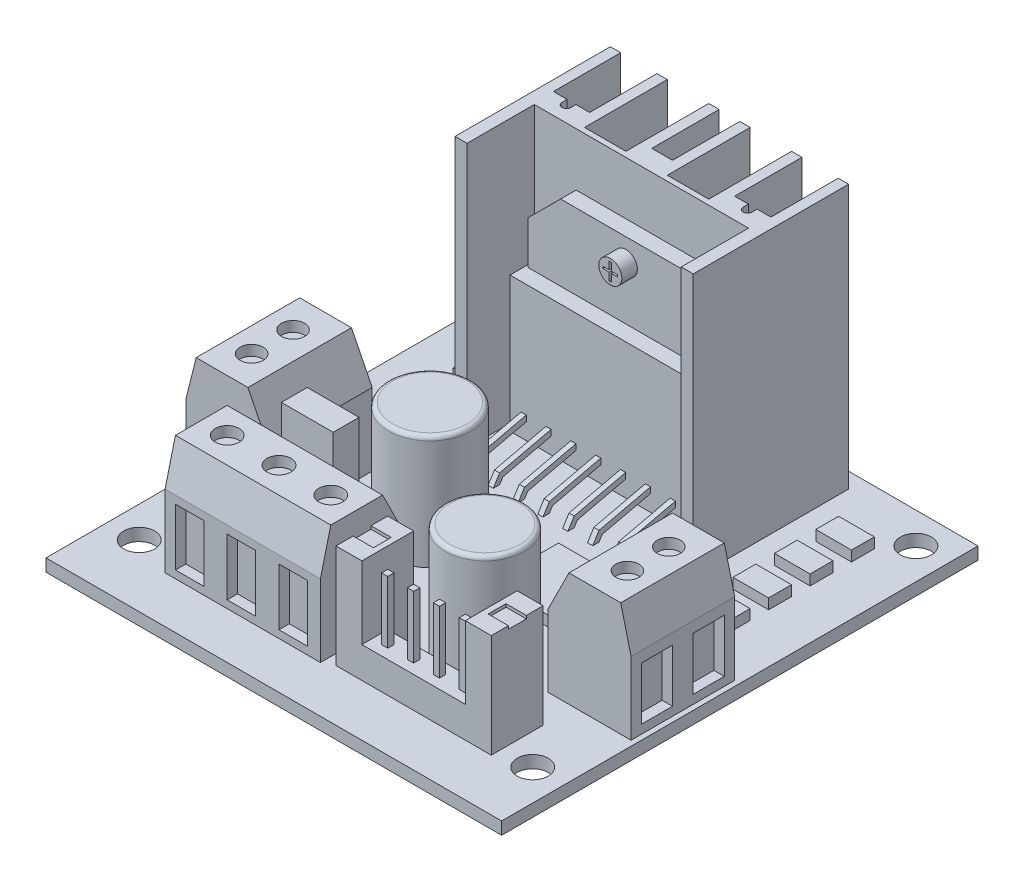
from build123d import *

# Parameters (mm, degrees)
CROQUIS1_W               = 44
CROQUIS1_H               = 46
CROQUIS1_R               = 1.5
SALIENTE_EXTRUIR1_DEPTH  = 1.2
SALIENTE_EXTRUIR2_DEPTH  = 25.5
CROQUIS3_W               = 19.365308418
CROQUIS3_H               = 6.533489043
SALIENTE_EXTRUIR3_DEPTH  = 1.5
CROQUIS4_W               = 19.365308418
CROQUIS4_H               = 13.066978086
CROQUIS4_R               = 1.114280983
SALIENTE_EXTRUIR4_DEPTH  = 1.5
SALIENTE_EXTRUIR5_DEPTH  = 0.25
MATRIZL1_COUNT           = 8
MATRIZL1_PITCH           = 2.4
CROQUIS7_W               = 3.447043621
CROQUIS7_H               = 2.206107918
CROQUIS7_W_2             = 5.797195258
CROQUIS7_H_2             = 6.532622161
SALIENTE_EXTRUIR6_DEPTH  = 1
CROQUIS8_W               = 8
CROQUIS8_H               = 10
SALIENTE_EXTRUIR7_DEPTH  = 11
CORTAR_EXTRUIR1_DEPTH    = 11
CROQUIS10_R              = 1.111029377
CORTAR_EXTRUIR2_DEPTH    = 1
CROQUIS11_W              = 3
CROQUIS11_H              = 5.114159263
CORTAR_EXTRUIR3_DEPTH    = 1
CROQUIS12_W              = 15
CROQUIS12_H              = 8
SALIENTE_EXTRUIR8_DEPTH  = 11
CORTAR_EXTRUIR4_DEPTH    = 15
CROQUIS14_R              = 1.153320406
CORTAR_EXTRUIR5_DEPTH    = 1
CROQUIS15_W              = 2.751640039
CROQUIS15_H              = 5.503280077
CORTAR_EXTRUIR6_DEPTH    = 1
CROQUIS16_W              = 15
CROQUIS16_H              = 2.5
SALIENTE_EXTRUIR9_DEPTH  = 3
CROQUIS17_W              = 0.6
CROQUIS17_H              = 0.6
SALIENTE_EXTRUIR10_DEPTH = 6
SALIENTE_EXTRUIR11_START = -3
CROQUIS18_W              = 2.5
CROQUIS18_H              = 5
SALIENTE_EXTRUIR11_DEPTH = 10
CROQUIS19_W              = 1.961135145
CROQUIS19_H              = 1.727519932
CORTAR_EXTRUIR7_DEPTH    = 0.3
CROQUIS20_R              = 3.991253797
CROQUIS20_R_2            = 3.810659562
CROQUIS20_W              = 5
CROQUIS20_H              = 2.5
SALIENTE_EXTRUIR12_DEPTH = 11
REDONDEO1_R              = 0.4


with BuildPart() as part:
    # Croquis1 → Saliente-Extruir1 (new body)
    with BuildSketch(Plane(origin=(0, 0, 0), x_dir=(1, 0, 0), z_dir=(0, 1, 0))):
        Rectangle(CROQUIS1_W, CROQUIS1_H)
        with Locations(Location((-19, 20, 0), (0, 0, 270))):
            Circle(CROQUIS1_R, mode=Mode.SUBTRACT)
        with Locations(Location((-19, -17, 0), (0, 0, 270))):
            Circle(CROQUIS1_R, mode=Mode.SUBTRACT)
        with Locations(Location((19, -17, 0), (0, 0, 90))):
            Circle(CROQUIS1_R, mode=Mode.SUBTRACT)
        with Locations(Location((19, 20, 0), (0, 0, 90))):
            Circle(CROQUIS1_R, mode=Mode.SUBTRACT)
    extrude(amount=SALIENTE_EXTRUIR1_DEPTH)

    # Croquis2 → Saliente-Extruir2 (add)
    with BuildSketch(Plane(origin=(0, 1.2, 0), x_dir=(1, 0, 0), z_dir=(0, 1, 0))):
        with BuildLine():
            Line((8.67693618, 15), (8.67693618, 14.506211674))
            ThreePointArc((8.67693618, 14.506211674), (8.25, 14.079275494), (7.82306382, 14.506211674))
            Line((7.82306382, 14.506211674), (7.82306382, 15))
            Line((7.82306382, 15), (6.5, 15))
            Line((6.5, 15), (6.5, 21.5))
            Line((6.5, 21.5), (5.5, 21.5))
            Line((5.5, 21.5), (5.5, 13.5))
            Line((5.5, 13.5), (1.5, 13.5))
            Line((1.5, 13.5), (1.5, 21.5))
            Line((1.5, 21.5), (0.5, 21.5))
            Line((0.5, 21.5), (0.5, 15))
            Line((0.5, 15), (-1.5, 15))
            Line((-1.5, 15), (-1.5, 21.5))
            Line((-1.5, 21.5), (-2.5, 21.5))
            Line((-2.5, 21.5), (-2.5, 13.5))
            Line((-2.5, 13.5), (-6.5, 13.5))
            Line((-6.5, 13.5), (-6.5, 21.5))
            Line((-6.5, 21.5), (-7.5, 21.5))
            Line((-7.5, 21.5), (-7.5, 15))
            Line((-7.5, 15), (-8.82306382, 15))
            Line((-8.82306382, 15), (-8.82306382, 14.506211674))
            ThreePointArc((-8.82306382, 14.506211674), (-9.25, 14.079275494), (-9.67693618, 14.506211674))
            Line((-9.67693618, 14.506211674), (-9.67693618, 15))
            Line((-9.67693618, 15), (-11, 15))
            Line((-11, 15), (-11, 21.5))
            Line((-11, 21.5), (-12, 21.5))
            Line((-12, 21.5), (-12, 6.5))
            Line((-12, 6.5), (-10.843156937, 6.5))
            Line((-10.843156937, 6.5), (-10.843156937, 7.006410896))
            Line((-10.843156937, 7.006410896), (-10.843156937, 12.993589104))
            Line((-10.843156937, 12.993589104), (9.843156937, 12.993589104))
            Line((9.843156937, 12.993589104), (9.843156937, 7.006410896))
            Line((9.843156937, 7.006410896), (9.843156937, 6.5))
            Line((9.843156937, 6.5), (11, 6.5))
            Line((11, 6.5), (11, 21.5))
            Line((11, 21.5), (10, 21.5))
            Line((10, 21.5), (10, 15))
            Line((10, 15), (8.67693618, 15))
        make_face()
    extrude(amount=SALIENTE_EXTRUIR2_DEPTH)

    # Croquis3 → Saliente-Extruir3 (add)
    with BuildSketch(Plane.XY.offset(-12.993589104)):
        Polygon((-9.937068109, 18.429294391), (-9.937068109, 14.266978086), (8.937068109, 14.266978086), (8.937068109, 18.429294391), (5.801399633, 21.564962866), (-6.801399633, 21.564962866), align=None)
        Polygon((-10.182654209, 14.266978086), (-10.182654209, 7.733489043), (9.182654209, 7.733489043), (9.182654209, 14.266978086), (8.937068109, 14.266978086), (-9.937068109, 14.266978086), align=None)
        with Locations((-0.5, 4.466744522)):
            Rectangle(CROQUIS3_W, CROQUIS3_H)
    extrude(amount=SALIENTE_EXTRUIR3_DEPTH)

    # Croquis4 → Saliente-Extruir4 (add)
    # profile 1 of 2: a face of its own
    with BuildSketch(Plane.XY.offset(-11.493589104)):
        with Locations((-0.5, 7.733489043)):
            Rectangle(CROQUIS4_W, CROQUIS4_H)
    # profile 2 of 2: a face of its own
    with BuildSketch(Plane.XY.offset(-11.493589104)):
        with Locations((-0.5, 19.387387499)):
            Circle(CROQUIS4_R)
        Polygon((-0.605818044, 19.476799013), (-0.605818044, 20.210681013), (-0.394181956, 20.210681013), (-0.394181956, 19.476799013), (0.195646193, 19.476799013), (0.195646193, 19.297975984), (-0.394181956, 19.297975984), (-0.394181956, 18.564093985), (-0.605818044, 18.564093985), (-0.605818044, 19.297975984), (-1.195646193, 19.297975984), (-1.195646193, 19.476799013), align=None, mode=Mode.SUBTRACT)
    extrude(amount=SALIENTE_EXTRUIR4_DEPTH)

    # Croquis6 → Saliente-Extruir5 (add, symmetric)
    with BuildSketch(Plane(origin=(7.932654209, 0, 0), x_dir=(0, 0, -1), z_dir=(1, 0, 0))):
        Polygon((9.993589104, 3.342388637), (5.02253535, 2.184888931), (4.409678304, 1.2), (5.02253535, 1.2), (5.328963873, 1.692444466), (9.993589104, 2.778592916), align=None)
    saliente_extruir5 = extrude(amount=SALIENTE_EXTRUIR5_DEPTH, both=True)

    # MatrizL1: Saliente-Extruir5 ×8
    with Locations(*[(-i * MATRIZL1_PITCH, 0, 0) for i in range(1, MATRIZL1_COUNT)]):
        add(saliente_extruir5)

    # Croquis7 → Saliente-Extruir6 (add)
    with BuildSketch(Plane(origin=(0, 1.2, 0), x_dir=(1, 0, 0), z_dir=(0, 1, 0))):
        with Locations((-15.511696297, 16.649220692)):
            Rectangle(CROQUIS7_W, CROQUIS7_H)
        with Locations((-15.511696297, 12.649220692)):
            Rectangle(CROQUIS7_W, CROQUIS7_H)
        with Locations((-15.511696297, 8.649220692)):
            Rectangle(CROQUIS7_W, CROQUIS7_H)
        with Locations((-15.511696297, 4.649220692)):
            Rectangle(CROQUIS7_W, CROQUIS7_H)
        with Locations((15.511696297, 4.649220692)):
            Rectangle(CROQUIS7_W, CROQUIS7_H)
        with Locations((15.511696297, 8.649220692)):
            Rectangle(CROQUIS7_W, CROQUIS7_H)
        with Locations((15.511696297, 12.649220692)):
            Rectangle(CROQUIS7_W, CROQUIS7_H)
        with Locations((15.511696297, 16.649220692)):
            Rectangle(CROQUIS7_W, CROQUIS7_H)
        with Locations((5.400924544, -1.273551097)):
            Rectangle(CROQUIS7_W_2, CROQUIS7_H_2)
    extrude(amount=SALIENTE_EXTRUIR6_DEPTH)

    # Croquis8 → Saliente-Extruir7 (add)
    with BuildSketch(Plane(origin=(0, 1.2, 0), x_dir=(1, 0, 0), z_dir=(0, 1, 0))):
        with Locations((-17.5, -5)):
            Rectangle(CROQUIS8_W, CROQUIS8_H)
    saliente_extruir7 = extrude(amount=SALIENTE_EXTRUIR7_DEPTH)

    # Croquis9 → Cortar-Extruir1 (cut)
    with BuildSketch(Plane.XY.offset(10)):
        Polygon((-21.5, 8.2), (-20.5, 12.2), (-21.5, 12.2), align=None)
        Polygon((-15.5, 12.2), (-13.5, 8.2), (-13.5, 12.2), align=None)
    cortar_extruir1 = extrude(amount=-CORTAR_EXTRUIR1_DEPTH, mode=Mode.SUBTRACT)

    # Croquis10 → Cortar-Extruir2 (cut)
    with BuildSketch(Plane(origin=(0, 12.2, 0), x_dir=(1, 0, 0), z_dir=(0, 1, 0))):
        with Locations(Location((-18.14474212, -3, 0), (0, 0, 270))):
            Circle(CROQUIS10_R)
        with Locations(Location((-18.14474212, -7, 0), (0, 0, 270))):
            Circle(CROQUIS10_R)
    cortar_extruir2 = extrude(amount=-CORTAR_EXTRUIR2_DEPTH, mode=Mode.SUBTRACT)

    # Croquis11 → Cortar-Extruir3 (cut)
    with BuildSketch(Plane.ZY.offset(21.5)):
        with Locations((2.5, 4.599585644)):
            Rectangle(CROQUIS11_W, CROQUIS11_H)
        with Locations((7.5, 4.599585644)):
            Rectangle(CROQUIS11_W, CROQUIS11_H)
    cortar_extruir3 = extrude(amount=-CORTAR_EXTRUIR3_DEPTH, mode=Mode.SUBTRACT)

    # Simetría1: Saliente-Extruir7, Cortar-Extruir1, Cortar-Extruir2, Cortar-Extruir3 across plane
    add(saliente_extruir7.mirror(Plane(origin=(0, 0, 0), x_dir=(0, 0, 1), z_dir=(1, 0, 0))))
    add(cortar_extruir1.mirror(Plane(origin=(0, 0, 0), x_dir=(0, 0, 1), z_dir=(1, 0, 0))), mode=Mode.SUBTRACT)
    add(cortar_extruir2.mirror(Plane(origin=(0, 0, 0), x_dir=(0, 0, 1), z_dir=(1, 0, 0))), mode=Mode.SUBTRACT)
    add(cortar_extruir3.mirror(Plane(origin=(0, 0, 0), x_dir=(0, 0, 1), z_dir=(1, 0, 0))), mode=Mode.SUBTRACT)

    # Croquis12 → Saliente-Extruir8 (add)
    with BuildSketch(Plane(origin=(0, 1.2, 0), x_dir=(1, 0, 0), z_dir=(0, 1, 0))):
        with Locations((-7.5, -14.5)):
            Rectangle(CROQUIS12_W, CROQUIS12_H)
    extrude(amount=SALIENTE_EXTRUIR8_DEPTH)

    # Croquis13 → Cortar-Extruir4 (cut)
    with BuildSketch(Plane(origin=(0, 0, 0), x_dir=(0, 0, -1), z_dir=(1, 0, 0))):
        Polygon((-18.5, 8.2), (-17.5, 12.2), (-18.5, 12.2), align=None)
        Polygon((-12.5, 12.2), (-10.5, 8.2), (-10.5, 12.2), align=None)
    extrude(amount=-CORTAR_EXTRUIR4_DEPTH, mode=Mode.SUBTRACT)

    # Croquis14 → Cortar-Extruir5 (cut)
    with BuildSketch(Plane(origin=(0, 12.2, 0), x_dir=(1, 0, 0), z_dir=(0, 1, 0))):
        with Locations(Location((-12.5, -15, 0), (0, 0, 270))):
            Circle(CROQUIS14_R)
        with Locations(Location((-7.5, -15, 0), (0, 0, 270))):
            Circle(CROQUIS14_R)
        with Locations(Location((-2.5, -15, 0), (0, 0, 270))):
            Circle(CROQUIS14_R)
    extrude(amount=-CORTAR_EXTRUIR5_DEPTH, mode=Mode.SUBTRACT)

    # Croquis15 → Cortar-Extruir6 (cut)
    with BuildSketch(Plane.XY.offset(18.5)):
        with Locations((-12.62417998, 4.690290979)):
            Rectangle(CROQUIS15_W, CROQUIS15_H)
        with Locations((-7.624179981, 4.690290979)):
            Rectangle(CROQUIS15_W, CROQUIS15_H)
        with Locations((-2.624179981, 4.690290979)):
            Rectangle(CROQUIS15_W, CROQUIS15_H)
    extrude(amount=-CORTAR_EXTRUIR6_DEPTH, mode=Mode.SUBTRACT)

    # Croquis16 → Saliente-Extruir9 (add)
    with BuildSketch(Plane(origin=(0, 1.2, 0), x_dir=(1, 0, 0), z_dir=(0, 1, 0))):
        with Locations((8.5, -16.75)):
            Rectangle(CROQUIS16_W, CROQUIS16_H)
    extrude(amount=SALIENTE_EXTRUIR9_DEPTH)

    # Croquis17 → Saliente-Extruir10 (add)
    with BuildSketch(Plane(origin=(0, 4.2, 0), x_dir=(1, 0, 0), z_dir=(0, 1, 0))):
        with Locations((2.25, -16.75)):
            Rectangle(CROQUIS17_W, CROQUIS17_H)
        with Locations((4.75, -16.75)):
            Rectangle(CROQUIS17_W, CROQUIS17_H)
        with Locations((7.25, -16.75)):
            Rectangle(CROQUIS17_W, CROQUIS17_H)
        with Locations((9.75, -16.75)):
            Rectangle(CROQUIS17_W, CROQUIS17_H)
        with Locations((12.25, -16.75)):
            Rectangle(CROQUIS17_W, CROQUIS17_H)
        with Locations((14.75, -16.75)):
            Rectangle(CROQUIS17_W, CROQUIS17_H)
    extrude(amount=SALIENTE_EXTRUIR10_DEPTH)

    # Croquis18 → Saliente-Extruir11 (add)
    with BuildSketch(Plane(origin=(0, 4.2, 0), x_dir=(1, 0, 0), z_dir=(0, 1, 0)).offset(SALIENTE_EXTRUIR11_START)):
        with Locations((2.25, -15.5)):
            Rectangle(CROQUIS18_W, CROQUIS18_H)
        with Locations((14.75, -15.5)):
            Rectangle(CROQUIS18_W, CROQUIS18_H)
    extrude(amount=SALIENTE_EXTRUIR11_DEPTH)

    # Croquis19 → Cortar-Extruir7 (cut)
    with BuildSketch(Plane(origin=(0, 11.2, 0), x_dir=(1, 0, 0), z_dir=(0, 1, 0))):
        with Locations((1.980567573, -15.479633985)):
            Rectangle(CROQUIS19_W, CROQUIS19_H)
        with Locations((15.019432427, -15.479633985)):
            Rectangle(CROQUIS19_W, CROQUIS19_H)
    extrude(amount=-CORTAR_EXTRUIR7_DEPTH, mode=Mode.SUBTRACT)

    # Croquis20 → Saliente-Extruir12 (add)
    with BuildSketch(Plane(origin=(0, 1.2, 0), x_dir=(1, 0, 0), z_dir=(0, 1, 0))):
        with Locations(Location((-5.460117096, -2.464636189, 0), (0, 0, 270))):
            Circle(CROQUIS20_R)
        with Locations(Location((7.355991088, -9.972297197, 0), (0, 0, 270))):
            Circle(CROQUIS20_R_2)
        with Locations((-10.13817835, -8.382004926)):
            Rectangle(CROQUIS20_W, CROQUIS20_H)
    extrude(amount=SALIENTE_EXTRUIR12_DEPTH)

    # Redondeo1
    redondeo1_edges = [part.edges().sort_by_distance(p)[0] for p in [
        (-5.460117096, 12.2, -1.526617607),
        (7.355991088, 12.2, 6.161637635),
    ]]
    fillet(redondeo1_edges, radius=REDONDEO1_R)


solid = part.part
